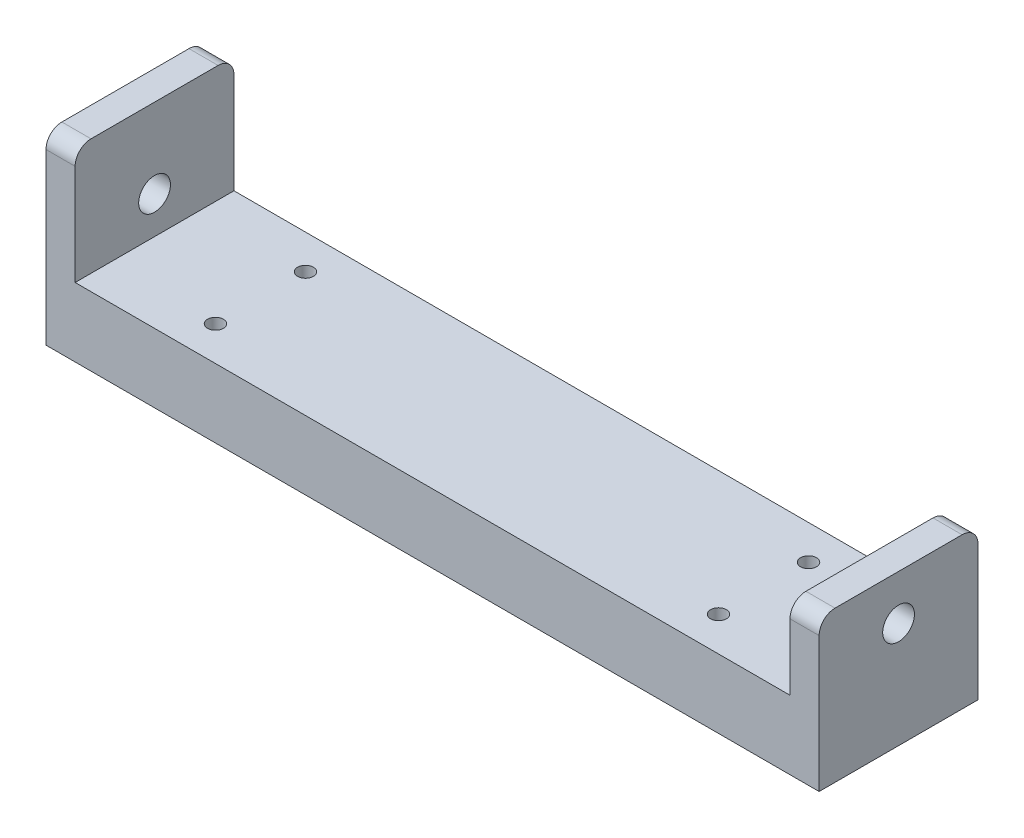
from build123d import *

# Parameters (mm, degrees)
EXTRUDE_1_DEPTH     = 15
CUT_EXTRUDE_1_REACH = 150.408
SKETCH_2_R          = 1.5
FILLET_2_R          = 3
SKETCH_3_R          = 3
CUT_EXTRUDE_2_DEPTH = 151.884061451


with BuildPart() as part:
    # 草图1 → 凸台-拉伸1 (new, symmetric)
    with BuildSketch(Plane.XY):
        Polygon((0, 0), (146, 0), (146, 28.5), (140.5, 28.5), (140.5, 13), (5.5, 13), (5.5, 35), (0, 35), align=None)
    extrude(amount=EXTRUDE_1_DEPTH, both=True)

    # 草图2 → 切除-拉伸1 (cut, up to next)
    with BuildSketch(Plane(origin=(0, 13, 0), x_dir=(1, 0, 0), z_dir=(0, 1, 0)), mode=Mode.PRIVATE) as cut_extrude_1_sk1:
        with Locations(Location((25.5, 8.5, 0), (0, 0, 180))):
            Circle(SKETCH_2_R)
    cut_extrude_1_tool1 = extrude(cut_extrude_1_sk1.sketch, amount=-CUT_EXTRUDE_1_REACH, mode=Mode.PRIVATE) & part.part
    # 草图2 → 切除-拉伸1 (cut, up to next)
    with BuildSketch(Plane(origin=(0, 13, 0), x_dir=(1, 0, 0), z_dir=(0, 1, 0)), mode=Mode.PRIVATE) as cut_extrude_1_sk2:
        with Locations(Location((120.5, 8.5, 0), (0, 0, 270))):
            Circle(SKETCH_2_R)
    cut_extrude_1_tool2 = extrude(cut_extrude_1_sk2.sketch, amount=-CUT_EXTRUDE_1_REACH, mode=Mode.PRIVATE) & part.part
    # 草图2 → 切除-拉伸1 (cut, up to next)
    with BuildSketch(Plane(origin=(0, 13, 0), x_dir=(1, 0, 0), z_dir=(0, 1, 0)), mode=Mode.PRIVATE) as cut_extrude_1_sk3:
        with Locations(Location((25.5, -8.5, 0), (0, 0, 270))):
            Circle(SKETCH_2_R)
    cut_extrude_1_tool3 = extrude(cut_extrude_1_sk3.sketch, amount=-CUT_EXTRUDE_1_REACH, mode=Mode.PRIVATE) & part.part
    # 草图2 → 切除-拉伸1 (cut, up to next)
    with BuildSketch(Plane(origin=(0, 13, 0), x_dir=(1, 0, 0), z_dir=(0, 1, 0)), mode=Mode.PRIVATE) as cut_extrude_1_sk4:
        with Locations(Location((120.5, -8.5, 0), (0, 0, 180))):
            Circle(SKETCH_2_R)
    cut_extrude_1_tool4 = extrude(cut_extrude_1_sk4.sketch, amount=-CUT_EXTRUDE_1_REACH, mode=Mode.PRIVATE) & part.part
    add(cut_extrude_1_tool1.solids().sort_by_distance((25.5, 13, -8.5))[0], mode=Mode.SUBTRACT)
    add(cut_extrude_1_tool2.solids().sort_by_distance((120.5, 13, -8.5))[0], mode=Mode.SUBTRACT)
    add(cut_extrude_1_tool3.solids().sort_by_distance((25.5, 13, 8.5))[0], mode=Mode.SUBTRACT)
    add(cut_extrude_1_tool4.solids().sort_by_distance((120.5, 13, 8.5))[0], mode=Mode.SUBTRACT)

    # 圆角2
    fillet_2_edges = [part.edges().sort_by_distance(p)[0] for p in [
        (143.25, 28.5, -15),
        (143.25, 28.5, 15),
        (2.75, 35, 15),
        (2.75, 35, -15),
    ]]
    fillet(fillet_2_edges, radius=FILLET_2_R)

    # 草图3 → 切除-拉伸2 (cut, through all)
    with BuildSketch(Plane.ZY):
        with Locations(Location((0, 20, 0), (0, 0, 270))):
            Circle(SKETCH_3_R)
    extrude(amount=-CUT_EXTRUDE_2_DEPTH, mode=Mode.SUBTRACT)


solid = part.part
